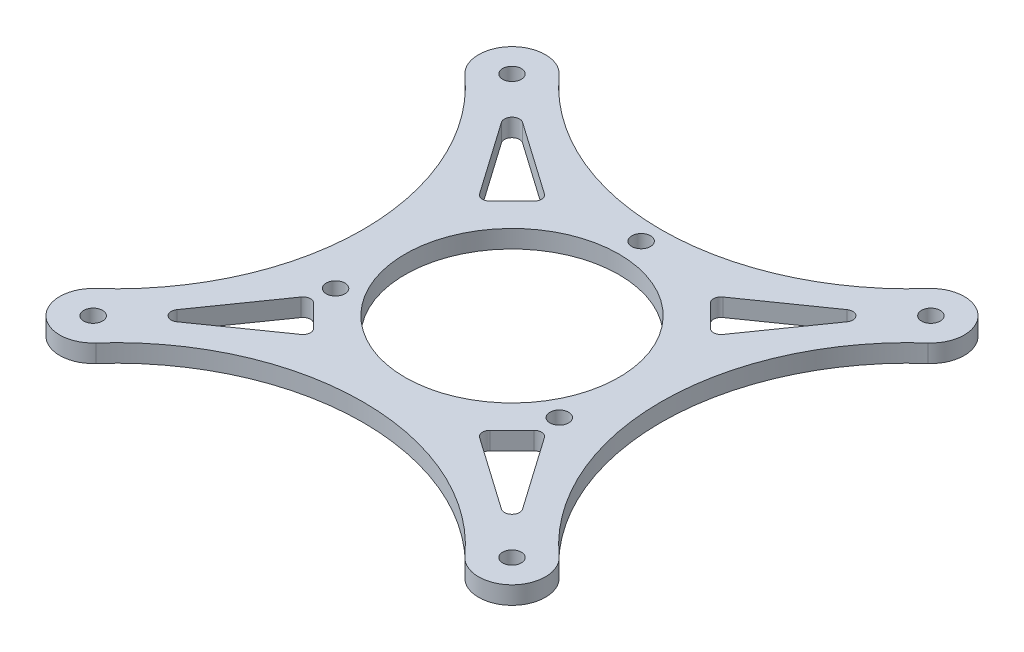
from build123d import *

# Parameters (mm, degrees)
SKETCH_1_R          = 2.1
SKETCH_1_R_2        = 15
EXTRUDE_1_DEPTH     = 4
SKETCH_3_R          = 24
CUT_EXTRUDE_2_DEPTH = 78.210284473
CUT_EXTRUDE_3_DEPTH = 78.210284473
FILLET_1_R          = 1.7


with BuildPart() as part:
    # 草图1 → 凸台-拉伸1 (new body)
    with BuildSketch(Plane(origin=(0, 0, 0), x_dir=(1, 0, 0), z_dir=(0, 1, 0))):
        with BuildLine():
            ThreePointArc((-41.42868058, 52.018404679), (-52.325901808, 52.325901808), (-52.018404679, 41.42868058))
            ThreePointArc((-52.018404679, 41.42868058), (-33.472279505, 0), (-52.018404679, -41.42868058))
            ThreePointArc((-52.018404679, -41.42868058), (-52.325901808, -52.325901808), (-41.42868058, -52.018404679))
            ThreePointArc((-41.42868058, -52.018404679), (0, -33.472279505), (41.42868058, -52.018404679))
            ThreePointArc((41.42868058, -52.018404679), (52.325901808, -52.325901808), (52.018404679, -41.42868058))
            ThreePointArc((52.018404679, -41.42868058), (33.472279505, 0), (52.018404679, 41.42868058))
            ThreePointArc((52.018404679, 41.42868058), (52.325901808, 52.325901808), (41.42868058, 52.018404679))
            ThreePointArc((41.42868058, 52.018404679), (0, 33.472279505), (-41.42868058, 52.018404679))
        make_face()
        with Locations(Location((0, 29, 0), (0, 0, 270))):
            Circle(SKETCH_1_R, mode=Mode.SUBTRACT)
        with Locations(Location((25.11473671, -14.5, 0), (0, 0, 270))):
            Circle(SKETCH_1_R, mode=Mode.SUBTRACT)
        with Locations(Location((-25.11473671, -14.5, 0), (0, 0, 270))):
            Circle(SKETCH_1_R, mode=Mode.SUBTRACT)
        with Locations(Location((47.022600949, 47.022600949, 0), (0, 0, 270))):
            Circle(SKETCH_1_R, mode=Mode.SUBTRACT)
        with Locations(Location((47.022600949, -47.022600949, 0), (0, 0, 90))):
            Circle(SKETCH_1_R, mode=Mode.SUBTRACT)
        with Locations(Location((-47.022600949, -47.022600949, 0), (0, 0, 270))):
            Circle(SKETCH_1_R, mode=Mode.SUBTRACT)
        with Locations(Location((-47.022600949, 47.022600949, 0), (0, 0, 90))):
            Circle(SKETCH_1_R, mode=Mode.SUBTRACT)
        with Locations(Location((0, 0, 0), (0, 0, 270))):
            Circle(SKETCH_1_R_2, mode=Mode.SUBTRACT)
    extrude(amount=EXTRUDE_1_DEPTH)

    # 草图3 → 切除-拉伸2 (cut, through all)
    with BuildSketch(Plane.XZ):
        with Locations(Location((0, 0, 0), (0, 0, 270))):
            Circle(SKETCH_3_R)
    extrude(amount=-CUT_EXTRUDE_2_DEPTH, mode=Mode.SUBTRACT)

    # 草图4 → 切除-拉伸3 (cut, through all)
    with BuildSketch(Plane.XZ):
        Polygon((-44.329973687, 44.329973687), (-26.162950904, 18.384776311), (-18.384776311, 26.162950904), align=None)
        Polygon((26.162950904, 18.384776311), (44.329973687, 44.329973687), (18.384776311, 26.162950904), align=None)
        Polygon((18.384776311, -26.162950904), (44.329973687, -44.329973687), (26.162950904, -18.384776311), align=None)
        Polygon((-26.162950904, -18.384776311), (-44.329973687, -44.329973687), (-18.384776311, -26.162950904), align=None)
    extrude(amount=-CUT_EXTRUDE_3_DEPTH, mode=Mode.SUBTRACT)

    # 圆角1
    fillet_1_edges = [part.edges().sort_by_distance(p)[0] for p in [
        (-18.384776311, 2, -26.162950904),
        (-44.329973687, 2, -44.329973687),
        (-26.162950904, 2, -18.384776311),
        (26.162950904, 2, -18.384776311),
        (44.329973687, 2, -44.329973687),
        (18.384776311, 2, -26.162950904),
        (18.384776311, 2, 26.162950904),
        (44.329973687, 2, 44.329973687),
        (26.162950904, 2, 18.384776311),
        (-44.329973687, 2, 44.329973687),
        (-18.384776311, 2, 26.162950904),
        (-26.162950904, 2, 18.384776311),
    ]]
    fillet(fillet_1_edges, radius=FILLET_1_R)


solid = part.part
